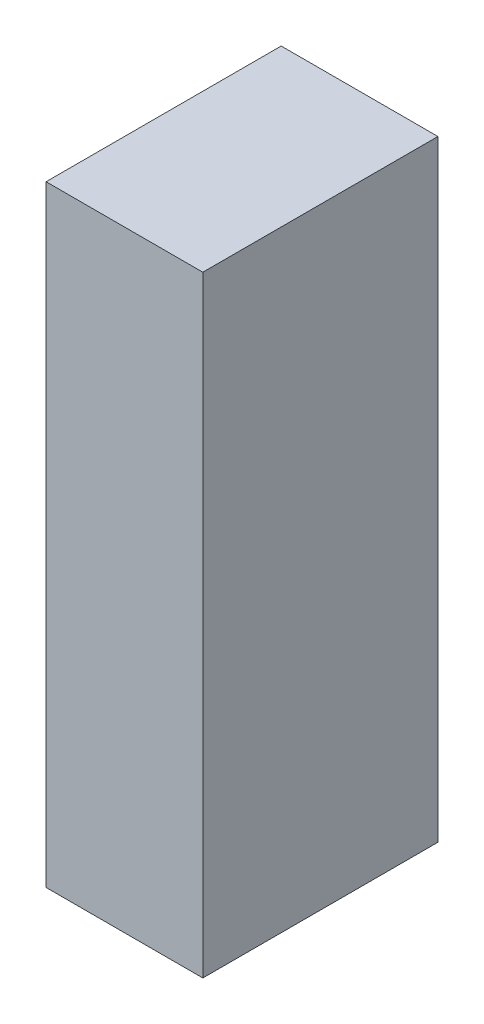
from build123d import *

# Parameters (mm, degrees)
SKETCH_1_W      = 15
SKETCH_1_H      = 39
EXTRUDE_1_DEPTH = 5


with BuildPart() as part:
    # 草图1 → 凸台-拉伸1 (new, symmetric)
    with BuildSketch(Plane(origin=(-22.124595338, 2e-09, -6.074327679), x_dir=(0, 0, -1), z_dir=(1, 0, 0))):
        with Locations((-38.5, -77.5)):
            Rectangle(SKETCH_1_W, SKETCH_1_H)
    extrude(amount=EXTRUDE_1_DEPTH, both=True)


solid = part.part
